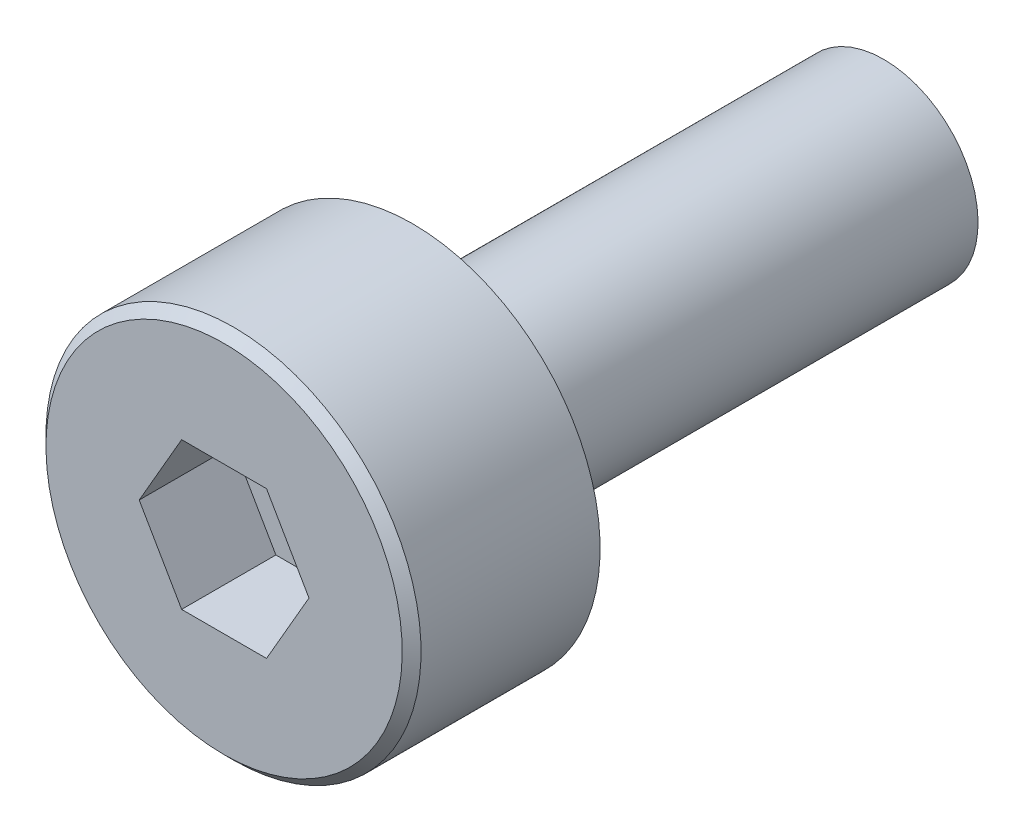
from build123d import *

# Parameters (mm, degrees)
CUT_EXTRUDE_1_DEPTH = 1
CHAMFER_627_SIZE    = 0.1


with BuildPart() as part:
    # 草图1 → 旋转1 (revolve)
    with BuildSketch(Plane(origin=(0, 0, 0), x_dir=(0, 0, -1), z_dir=(1, 0, 0))):
        Polygon((0, 0), (0, 1.99), (2, 1.99), (2, 1), (7, 1), (7, 0), align=None)
    revolve(axis=Axis((0, 0, -7), (0, 0, 1)))

    # 草图2 → 切除-拉伸1 (cut)
    with BuildSketch(Plane.XY):
        Polygon((0.45033321, 0.78), (-0.45033321, 0.78), (-0.90066642, 0), (-0.45033321, -0.78), (0.45033321, -0.78), (0.90066642, 0), align=None)
    extrude(amount=-CUT_EXTRUDE_1_DEPTH, mode=Mode.SUBTRACT)

    # Chamfer 627
    chamfer_627_edges = [part.edges().sort_by_distance(p)[0] for p in [
        (0, -1.99, 0),
    ]]
    chamfer(chamfer_627_edges, length=CHAMFER_627_SIZE)


solid = part.part
